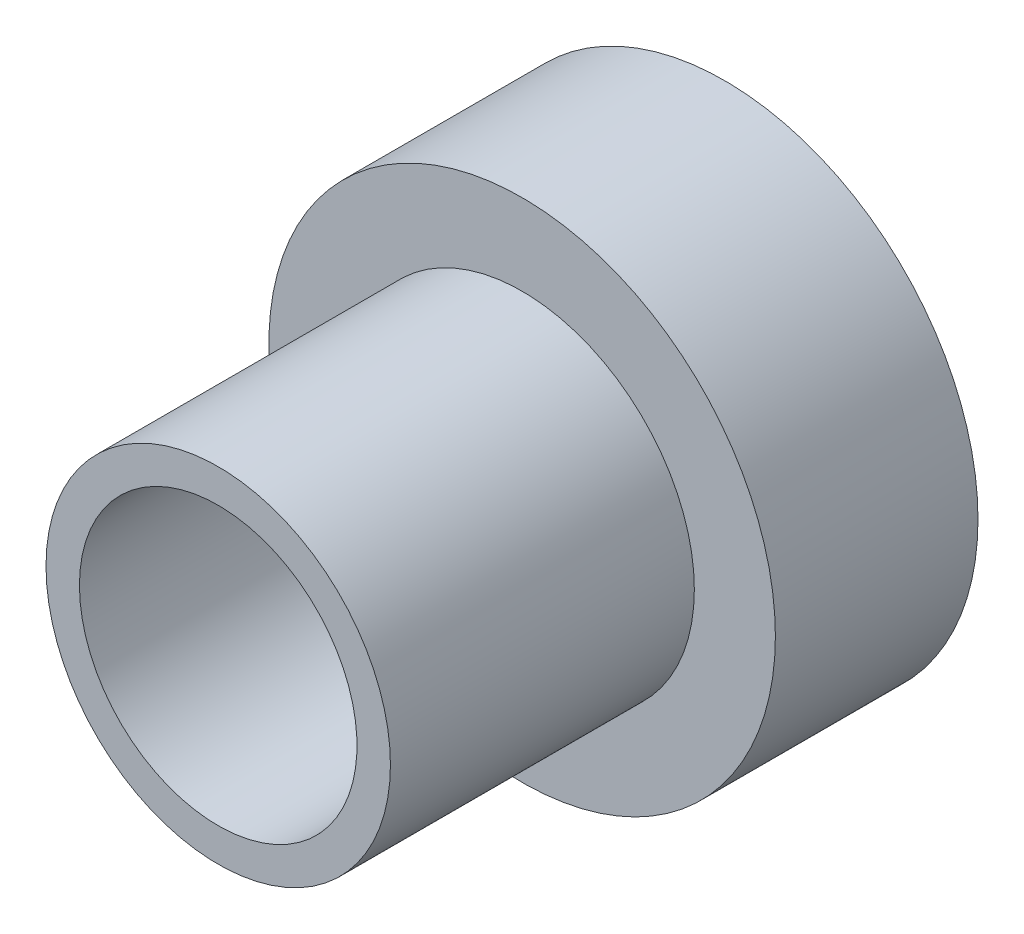
from build123d import *

# Parameters (mm, degrees)
SKETCH1_R           = 12.5
BOSS_EXTRUDE1_DEPTH = 12.5
SKETCH2_R           = 6.85
CUT_EXTRUDE1_DEPTH  = 25
SKETCH3_OUTSIDE_W   = 35.66
SKETCH3_OUTSIDE_H   = 35.66
SKETCH3_OUTSIDE_R   = 8.5
CUT_EXTRUDE2_DEPTH  = 15


with BuildPart() as part:
    # Sketch1 → Boss-Extrude1 (new, symmetric)
    with BuildSketch(Plane.XY):
        Circle(SKETCH1_R)
    extrude(amount=BOSS_EXTRUDE1_DEPTH, both=True)

    # Sketch2 → Cut-Extrude1 (cut)
    with BuildSketch(Plane(origin=(0, 0, -12.5), x_dir=(-1, 0, 0), z_dir=(0, 0, -1))):
        Circle(SKETCH2_R)
    extrude(amount=-CUT_EXTRUDE1_DEPTH, mode=Mode.SUBTRACT)

    # Sketch3 outside → Cut-Extrude2 (cut)
    with BuildSketch(Plane.XY.offset(12.5)):
        Rectangle(SKETCH3_OUTSIDE_W, SKETCH3_OUTSIDE_H)
        Circle(SKETCH3_OUTSIDE_R, mode=Mode.SUBTRACT)
    extrude(amount=-CUT_EXTRUDE2_DEPTH, mode=Mode.SUBTRACT)


solid = part.part
